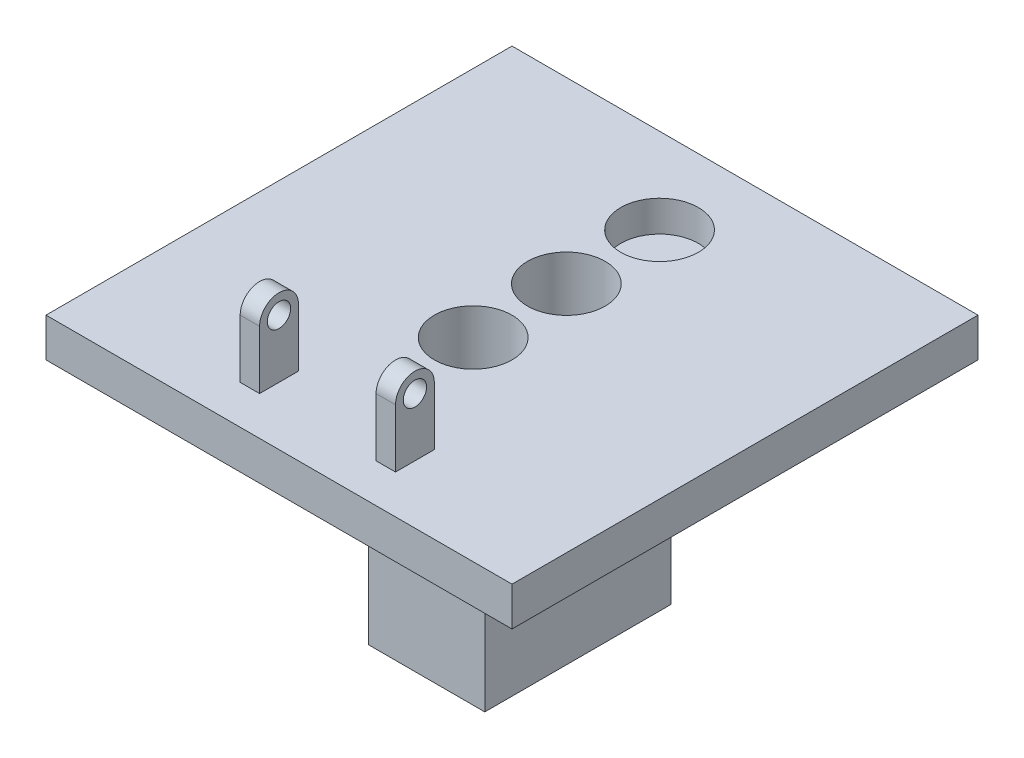
from build123d import *

# Parameters (mm, degrees)
SKETCH1_W           = 152.4
SKETCH1_H           = 152.4
BOSS_EXTRUDE1_DEPTH = 12.7
SKETCH2_W           = 12.7
SKETCH2_H           = 25.4
BOSS_EXTRUDE2_DEPTH = 25.4
FILLET1_RADIUS      = 6.35
FILLET1_LENGTH      = 50.8
SKETCH3_W           = 38.1
SKETCH3_H           = 35.536125939
CUT_EXTRUDE1_DEPTH  = 50.8
SKETCH4_R           = 3.81
CUT_EXTRUDE2_DEPTH  = 50.8
SKETCH11_W          = 19.05
SKETCH11_H          = 30.48
BOSS_EXTRUDE6_DEPTH = 76.2
SKETCH14_R          = 12.7
CUT_EXTRUDE3_DEPTH  = 76.2
SKETCH14_3_R        = 12.7
CUT_EXTRUDE4_DEPTH  = 10.16


with BuildPart() as part:
    # Sketch1 → Boss-Extrude1 (new body)
    with BuildSketch(Plane(origin=(0, 0, 0), x_dir=(1, 0, 0), z_dir=(0, 1, 0))):
        Rectangle(SKETCH1_W, SKETCH1_H)
    extrude(amount=BOSS_EXTRUDE1_DEPTH)

    # Sketch2 → Boss-Extrude2 (add, symmetric)
    with BuildSketch(Plane(origin=(0, 0, 0), x_dir=(0, 0, -1), z_dir=(1, 0, 0))):
        with Locations((-57.15, 25.4)):
            Rectangle(SKETCH2_W, SKETCH2_H)
    extrude(amount=BOSS_EXTRUDE2_DEPTH, both=True)

    # Fillet1: full round fillet: the end face becomes a half cylinder, R = half its width
    fillet1_face = Plane((0, 38.1, 57.15), x_dir=(1, 0, 0), z_dir=(0, 1, 0))  # on the end face: x along it, z out of the body
    fillet1_slab = fillet1_face.offset(-FILLET1_RADIUS / 2) * Box(FILLET1_LENGTH, 2 * FILLET1_RADIUS, FILLET1_RADIUS, mode=Mode.PRIVATE)  # the body's end, R deep
    fillet1_round = Plane((0, 31.75, 57.15), x_dir=(0, 1, 0), z_dir=(1, 0, 0)) * Cylinder(FILLET1_RADIUS, FILLET1_LENGTH, mode=Mode.PRIVATE)  # its axis R under the face
    add(fillet1_slab - fillet1_round, mode=Mode.SUBTRACT)

    # Sketch3 → Cut-Extrude1 (cut)
    with BuildSketch(Plane.XY.offset(63.5)):
        with Locations((0, 30.46806297)):
            Rectangle(SKETCH3_W, SKETCH3_H)
    extrude(amount=-CUT_EXTRUDE1_DEPTH, mode=Mode.SUBTRACT)

    # Sketch4 → Cut-Extrude2 (cut)
    with BuildSketch(Plane(origin=(25.4, 0, 0), x_dir=(0, 0, -1), z_dir=(1, 0, 0))):
        with Locations((-57.15, 31.75)):
            Circle(SKETCH4_R)
    extrude(amount=-CUT_EXTRUDE2_DEPTH, mode=Mode.SUBTRACT)

    # Sketch11 → Boss-Extrude6 (add)
    with BuildSketch(Plane.XZ):
        with Locations((-9.525, -17.78)):
            Rectangle(SKETCH11_W, SKETCH11_H)
        with Locations((9.525, -17.78)):
            Rectangle(SKETCH11_W, SKETCH11_H)
        with Locations((9.525, 12.7)):
            Rectangle(SKETCH11_W, SKETCH11_H)
        with Locations((-9.525, 12.7)):
            Rectangle(SKETCH11_W, SKETCH11_H)
    extrude(amount=BOSS_EXTRUDE6_DEPTH)

    # Sketch14 → Cut-Extrude3 (cut)
    with BuildSketch(Plane(origin=(0, 12.7, 0), x_dir=(1, 0, 0), z_dir=(0, 1, 0))):
        with Locations(Location((0, 17.78, 0), (0, 0, 270))):
            Circle(SKETCH14_R)
        with Locations(Location((0, -12.7, 0), (0, 0, 270))):
            Circle(SKETCH14_R)
    extrude(amount=-CUT_EXTRUDE3_DEPTH, mode=Mode.SUBTRACT)

    # Sketch14<3> → Cut-Extrude4 (cut)
    with BuildSketch(Plane(origin=(0, 12.7, 0), x_dir=(1, 0, 0), z_dir=(0, 1, 0))):
        with Locations(Location((0, 48.26, 0), (0, 0, 270))):
            Circle(SKETCH14_3_R)
    extrude(amount=-CUT_EXTRUDE4_DEPTH, mode=Mode.SUBTRACT)


solid = part.part
